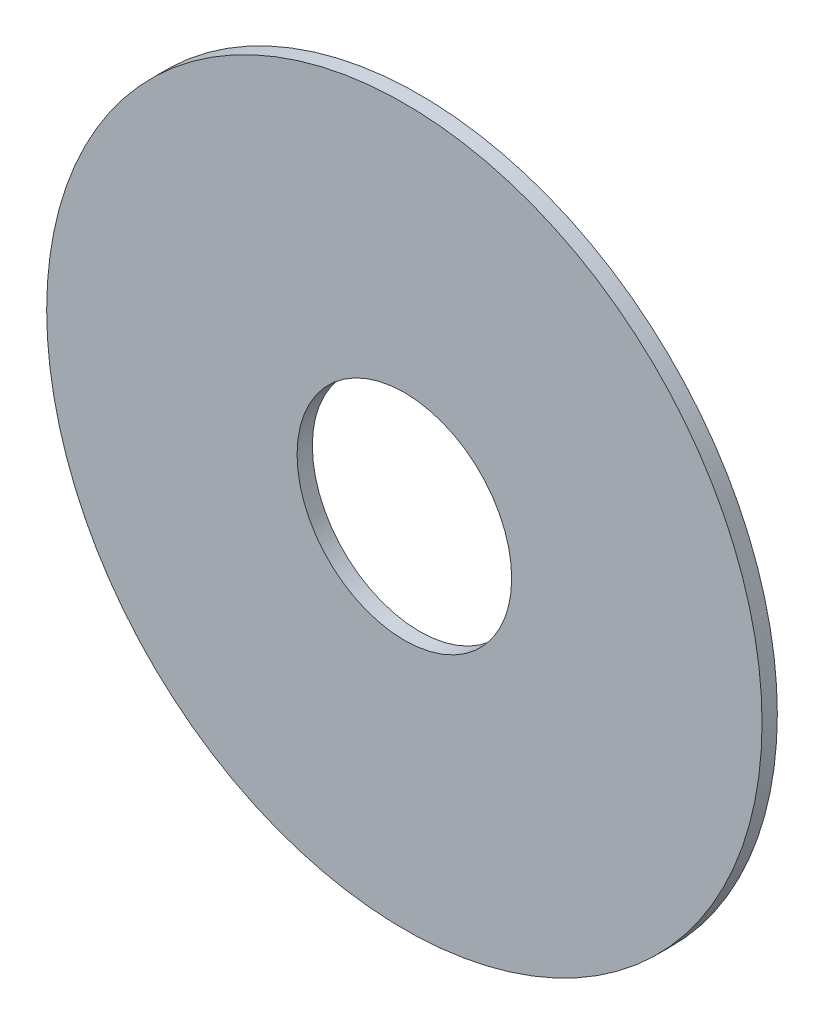
from build123d import *

# Parameters (mm, degrees)
SKETCH1_R           = 19.05
SKETCH1_R_2         = 5.715
BOSS_EXTRUDE1_DEPTH = 0.8128


with BuildPart() as part:
    # Sketch1 → Boss-Extrude1 (new body)
    with BuildSketch(Plane.XY):
        Circle(SKETCH1_R)
        Circle(SKETCH1_R_2, mode=Mode.SUBTRACT)
    extrude(amount=BOSS_EXTRUDE1_DEPTH)


solid = part.part
